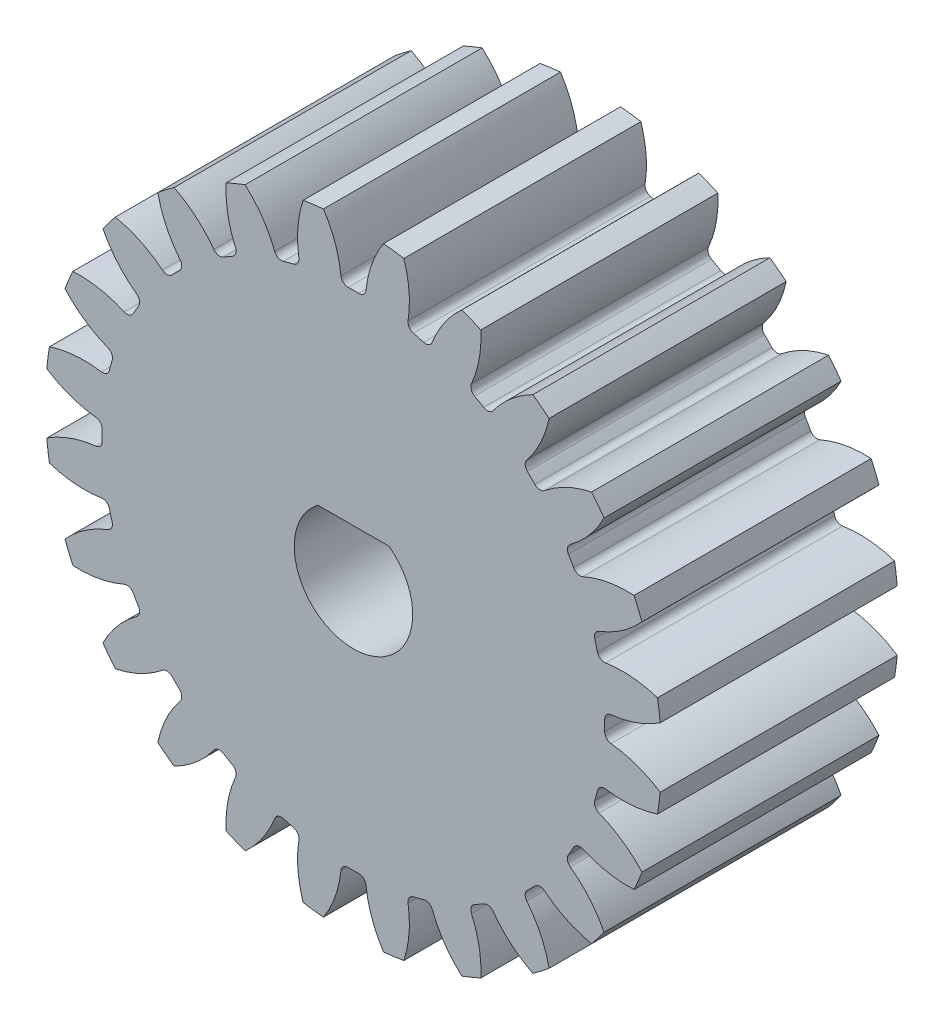
from build123d import *

# Parameters (mm, degrees)
SKETCH2_R                = 13
BOSS_EXTRUDE1_DEPTH      = 5
CUT_EXTRUDE1_DEPTH       = 20.052558883
FILLET1_R                = 0.3
CIRPATTERN1_COUNT        = 24
FILLET1_OF_CIRPATTERN1_R = 0.3
CUT_EXTRUDE3_DEPTH       = 10


with BuildPart() as part:
    # Sketch2 → Boss-Extrude1 (new, symmetric)
    with BuildSketch(Plane.XY):
        Circle(SKETCH2_R)
    extrude(amount=BOSS_EXTRUDE1_DEPTH, both=True)

    # Sketch3 → Cut-Extrude1 (cut, symmetric)
    with BuildSketch(Plane.XY):
        with BuildLine():
            ThreePointArc((0.506089511, 10.587911664), (0, 10.6), (-0.506089511, 10.587911664))
            ThreePointArc((-0.506089511, 10.587911664), (-0.729660429, 11.813766987), (-1.266792119, 12.938131153))
            ThreePointArc((-1.266792119, 12.938131153), (0, 13), (1.266792119, 12.938131153))
            ThreePointArc((1.266792119, 12.938131153), (0.729660429, 11.813766987), (0.506089511, 10.587911664))
        make_face()
    cut_extrude1 = extrude(amount=CUT_EXTRUDE1_DEPTH, both=True, mode=Mode.SUBTRACT)

    # Fillet1
    fillet1_edges = [part.edges().sort_by_distance(p)[0] for p in [
        (0.506089511, 10.587911664, 0),
        (-0.506089511, 10.587911664, 0),
    ]]
    fillet(fillet1_edges, radius=FILLET1_R)

    # CirPattern1: Cut-Extrude1 ×24 about axis
    cirpattern1_axis = Axis((0, 0, -11), (0, 0, 1))
    for i in range(1, CIRPATTERN1_COUNT):
        add(cut_extrude1.rotate(cirpattern1_axis, i * 360 / CIRPATTERN1_COUNT), mode=Mode.SUBTRACT)

    # Fillet1 of CirPattern1
    fillet1_of_cirpattern1_edges = [part.edges().sort_by_distance(p)[0] for p in [
        (-2.251508257, 10.358122927, 0),
        (-3.229198116, 10.096151719, 0),
        (-4.855669459, 9.42244523, 0),
        (-5.732242206, 8.916355718, 0),
        (-7.128924811, 7.844643462, 0),
        (-7.844643462, 7.128924811, 0),
        (-8.916355718, 5.732242206, 0),
        (-9.42244523, 4.855669459, 0),
        (-10.096151719, 3.229198116, 0),
        (-10.358122927, 2.251508257, 0),
        (-10.587911664, 0.506089511, 0),
        (-10.587911664, -0.506089511, 0),
        (-10.358122927, -2.251508257, 0),
        (-10.096151719, -3.229198116, 0),
        (-9.42244523, -4.855669459, 0),
        (-8.916355718, -5.732242206, 0),
        (-7.844643462, -7.128924811, 0),
        (-7.128924811, -7.844643462, 0),
        (-5.732242206, -8.916355718, 0),
        (-4.855669459, -9.42244523, 0),
        (-3.229198116, -10.096151719, 0),
        (-2.251508257, -10.358122927, 0),
        (-0.506089511, -10.587911664, 0),
        (0.506089511, -10.587911664, 0),
        (2.251508257, -10.358122927, 0),
        (3.229198116, -10.096151719, 0),
        (4.855669459, -9.42244523, 0),
        (5.732242206, -8.916355718, 0),
        (7.128924811, -7.844643462, 0),
        (7.844643462, -7.128924811, 0),
        (8.916355718, -5.732242206, 0),
        (9.42244523, -4.855669459, 0),
        (10.096151719, -3.229198116, 0),
        (10.358122927, -2.251508257, 0),
        (10.587911664, -0.506089511, 0),
        (10.587911664, 0.506089511, 0),
        (10.358122927, 2.251508257, 0),
        (10.096151719, 3.229198116, 0),
        (9.42244523, 4.855669459, 0),
        (8.916355718, 5.732242206, 0),
        (7.844643462, 7.128924811, 0),
        (7.128924811, 7.844643462, 0),
        (5.732242206, 8.916355718, 0),
        (4.855669459, 9.42244523, 0),
        (3.229198116, 10.096151719, 0),
        (2.251508257, 10.358122927, 0),
    ]]
    fillet(fillet1_of_cirpattern1_edges, radius=FILLET1_OF_CIRPATTERN1_R)

    # Sketch4 → Cut-Extrude3 (cut)
    with BuildSketch(Plane(origin=(0, 0, -5), x_dir=(-1, 0, 0), z_dir=(0, 0, -1))):
        with BuildLine():
            Line((-1.5, 2), (1.5, 2))
            ThreePointArc((1.5, 2), (0, -2.5), (-1.5, 2))
        make_face()
    extrude(amount=-CUT_EXTRUDE3_DEPTH, mode=Mode.SUBTRACT)


solid = part.part
